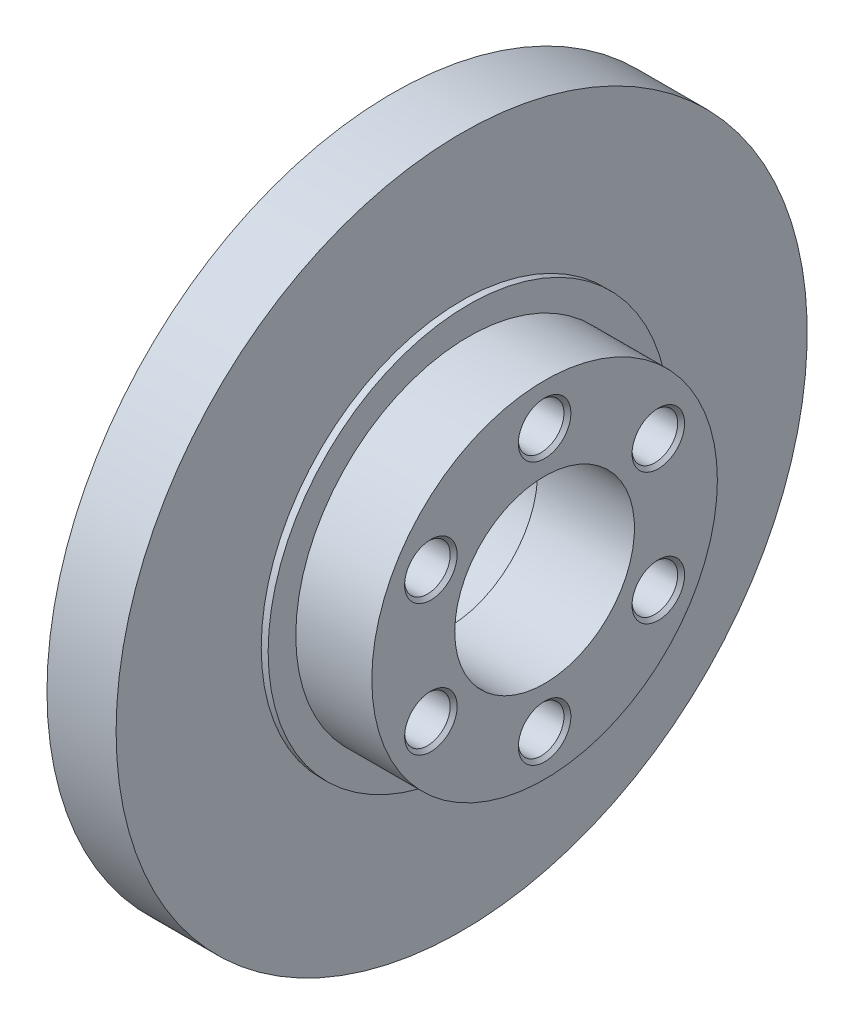
from build123d import *

# Parameters (mm, degrees)
SKETCH3_R          = 2.5
CUT_EXTRUDE1_DEPTH = 4
SKETCH4_R          = 3.3
CUT_EXTRUDE2_DEPTH = 10
CHAMFER1_SIZE      = 0.5


with BuildPart() as part:
    # Sketch2 → Revolve1 (revolve)
    with BuildSketch(Plane.XY, mode=Mode.PRIVATE) as revolve1_sk:
        Polygon((0, 50), (10, 50), (10, 29), (11, 29), (11, 25), (22, 25), (22, 13), (8, 13), (8, 14), (0, 14), align=None)
    revolve(revolve1_sk.sketch.rotate(Axis((0, 0, 0), (1, 0, 0)), 90), axis=Axis((0, 0, 0), (1, 0, 0)))

    # Sketch3 → Cut-Extrude1 (cut)
    with BuildSketch(Plane(origin=(0, 0, 0), x_dir=(0, 0, -1), z_dir=(1, 0, 0))):
        with Locations((0, 40)):
            Circle(SKETCH3_R)
        with Locations((28.284271247, 28.284271247)):
            Circle(SKETCH3_R)
        with Locations((40, 0)):
            Circle(SKETCH3_R)
        with Locations((28.284271247, -28.284271247)):
            Circle(SKETCH3_R)
        with Locations((0, -40)):
            Circle(SKETCH3_R)
        with Locations((-28.284271247, -28.284271247)):
            Circle(SKETCH3_R)
        with Locations((-40, 0)):
            Circle(SKETCH3_R)
        with Locations((-28.284271247, 28.284271247)):
            Circle(SKETCH3_R)
    extrude(amount=CUT_EXTRUDE1_DEPTH, mode=Mode.SUBTRACT)

    # Sketch4 → Cut-Extrude2 (cut)
    with BuildSketch(Plane(origin=(22, 0, 0), x_dir=(0, 0, -1), z_dir=(1, 0, 0))):
        with Locations((0, 19)):
            Circle(SKETCH4_R)
        with Locations((16.454482672, 9.5)):
            Circle(SKETCH4_R)
        with Locations((16.454482672, -9.5)):
            Circle(SKETCH4_R)
        with Locations((0, -19)):
            Circle(SKETCH4_R)
        with Locations((-16.454482672, -9.5)):
            Circle(SKETCH4_R)
        with Locations((-16.454482672, 9.5)):
            Circle(SKETCH4_R)
    extrude(amount=-CUT_EXTRUDE2_DEPTH, mode=Mode.SUBTRACT)

    # Chamfer1
    chamfer1_edges = [part.edges().sort_by_distance(p)[0] for p in [
        (22, 19, 3.3),
        (22, 9.5, 19.754482672),
        (22, -9.5, 19.754482672),
        (22, -19, 3.3),
        (22, -9.5, -13.154482672),
        (22, 9.5, -13.154482672),
    ]]
    chamfer(chamfer1_edges, length=CHAMFER1_SIZE)


solid = part.part
